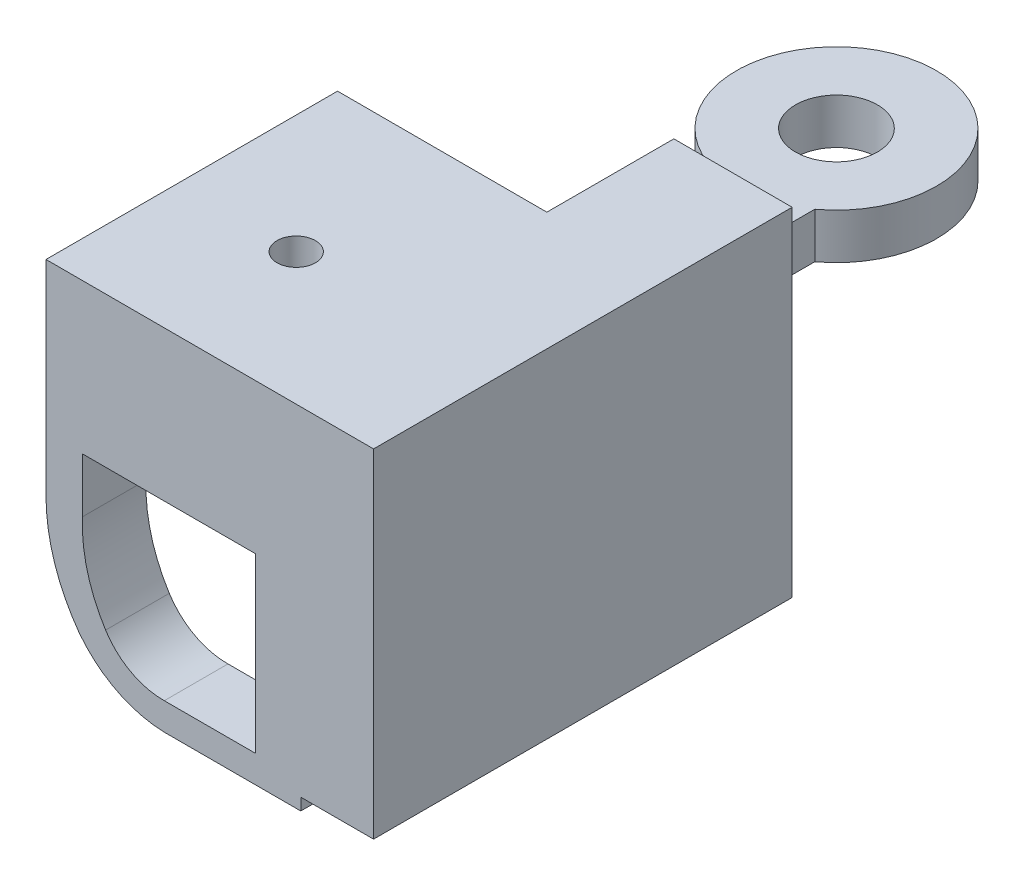
from build123d import *

# Parameters (mm, degrees)
BOSS_EXTRUDE1_DEPTH = 46
SKETCH3_W           = 23
SKETCH3_H           = 15
CUT_EXTRUDE2_DEPTH  = 28
SKETCH4_W           = 23
SKETCH4_H           = 13.957917361
CUT_EXTRUDE3_DEPTH  = 69
SKETCH8_W           = 15.108089283
SKETCH8_H           = 2.529188453
CUT_EXTRUDE4_DEPTH  = 5
SKETCH9_R           = 2.111646756
CUT_EXTRUDE5_DEPTH  = 22
SKETCH7_R           = 11
SKETCH7_R_2         = 4.5
BOSS_EXTRUDE2_DEPTH = 5
BOSS_EXTRUDE3_DEPTH = 5


with BuildPart() as part:
    # Sketch1 → Boss-Extrude1 (new body)
    with BuildSketch(Plane.XY):
        with BuildLine():
            Line((-22.718454064, 23.966100395), (13.281542119, 23.93479699))
            Line((13.281542119, 23.93479699), (13.281542119, -13.210798183))
            Line((13.281542119, -13.210798183), (5.281545459, -13.210798183))
            Line((5.281545459, -13.210798183), (5.281545459, -14.529188453))
            Line((5.281545459, -14.529188453), (-9.718454064, -14.529188453))
            ThreePointArc((-9.718454064, -14.529188453), (-14.925713646, -13.200176165), (-19.056981743, -9.762960731))
            ThreePointArc((-19.056981743, -9.762960731), (-21.779979177, -4.437922335), (-22.718454064, 1.468854607))
            Line((-22.718454064, 1.468854607), (-22.718454064, 23.966100395))
        make_face()
        with BuildLine():
            Line((-18.718455971, 7.468114556), (0.281544029, 7.468114556))
            Line((0.281544029, 7.468114556), (0.281544029, -11.529558479))
            Line((0.281544029, -11.529558479), (-9.718454064, -11.529558479))
            ThreePointArc((-9.718454064, -11.529558479), (-13.398330557, -10.623193541), (-16.168405236, -8.036752998))
            ThreePointArc((-16.168405236, -8.036752998), (-18.168441603, -3.478446477), (-18.718455971, 1.468854607))
            Line((-18.718455971, 1.468854607), (-18.718455971, 7.468114556))
        make_face(mode=Mode.SUBTRACT)
    extrude(amount=BOSS_EXTRUDE1_DEPTH)

    # Sketch3 → Cut-Extrude2 (cut)
    with BuildSketch(Plane.XZ.offset(14.529188453)):
        with Locations((-11.218454064, 31.5)):
            Rectangle(SKETCH3_W, SKETCH3_H)
    extrude(amount=-CUT_EXTRUDE2_DEPTH, mode=Mode.SUBTRACT)

    # Sketch4 → Cut-Extrude3 (cut)
    with BuildSketch(Plane.XZ.offset(14.529188453)):
        with Locations((-11.218454064, 6.978958681)):
            Rectangle(SKETCH4_W, SKETCH4_H)
    extrude(amount=-CUT_EXTRUDE3_DEPTH, mode=Mode.SUBTRACT)

    # Sketch8 → Cut-Extrude4 (cut)
    with BuildSketch(Plane.ZY.offset(22.718454064)):
        with Locations((31.445955359, 14.735405774)):
            Rectangle(SKETCH8_W, SKETCH8_H)
    extrude(amount=-CUT_EXTRUDE4_DEPTH, mode=Mode.SUBTRACT)

    # Sketch9 → Cut-Extrude5 (cut)
    with BuildSketch(Plane.XZ.offset(-13.470811547)):
        with Locations(Location((-9.718454064, 31.5, 0), (0, 0, 270))):
            Circle(SKETCH9_R)
    extrude(amount=-CUT_EXTRUDE5_DEPTH, mode=Mode.SUBTRACT)



with BuildPart() as body_2:
    # Sketch7 → Boss-Extrude2 (new body)
    with BuildSketch(Plane(origin=(0, 16, 0), x_dir=(1, 0, 0), z_dir=(0, 1, 0))):
        with Locations(Location((0.281545936, 17.870886738, 0), (0, 0, 270))):
            Circle(SKETCH7_R)
        with Locations(Location((0.281545936, 17.870886738, 0), (0, 0, 270))):
            Circle(SKETCH7_R_2, mode=Mode.SUBTRACT)
    extrude(amount=-BOSS_EXTRUDE2_DEPTH)


with BuildPart() as part_1:
    add(part.part)

    add(body_2.part)  # Boss-Extrude3 merges body 2
    # Sketch10 → Boss-Extrude3 (add)
    with BuildSketch(Plane(origin=(0, 16, 0), x_dir=(1, 0, 0), z_dir=(0, 1, 0))):
        with BuildLine():
            Line((0.281545936, 0), (0.281545936, 6.870886738))
            ThreePointArc((0.281545936, 6.870886738), (3.700951455, 7.415856087), (6.781544028, 8.996765665))
            Line((6.781544028, 8.996765665), (6.781544028, 0))
            Line((6.781544028, 0), (0.281545936, 0))
        make_face()
    extrude(amount=-BOSS_EXTRUDE3_DEPTH)


solid = part_1.part
